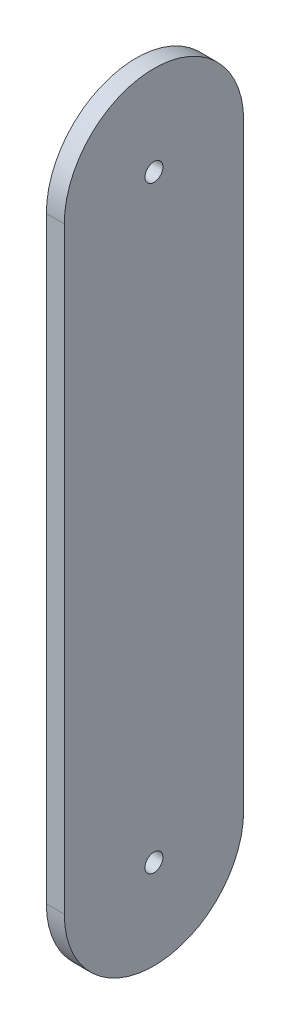
from build123d import *

# Parameters (mm, degrees)
SKETCH1_R           = 1.5
BOSS_EXTRUDE1_DEPTH = 3
SKETCH2_R           = 1.5
CUT_EXTRUDE1_DEPTH  = 10


with BuildPart() as part:
    # Sketch1 → Boss-Extrude1 (new body)
    with BuildSketch(Plane(origin=(0, 0, 0), x_dir=(0, 0, -1), z_dir=(1, 0, 0))):
        with BuildLine():
            Line((0.169822647, 50), (0.169822647, -50))
            ThreePointArc((0.169822647, -50), (-14.830177353, -65), (-29.830177353, -50))
            Line((-29.830177353, -50), (-29.830177353, 50))
            ThreePointArc((-29.830177353, 50), (-14.830177353, 65), (0.169822647, 50))
        make_face()
        with Locations((-14.830177353, -50)):
            Circle(SKETCH1_R, mode=Mode.SUBTRACT)
    extrude(amount=BOSS_EXTRUDE1_DEPTH)

    # Sketch2 → Cut-Extrude1 (cut)
    with BuildSketch(Plane(origin=(3, 0, 0), x_dir=(0, 0, -1), z_dir=(1, 0, 0))):
        with Locations((-14.830177353, 50)):
            Circle(SKETCH2_R)
    extrude(amount=-CUT_EXTRUDE1_DEPTH, mode=Mode.SUBTRACT)


solid = part.part
